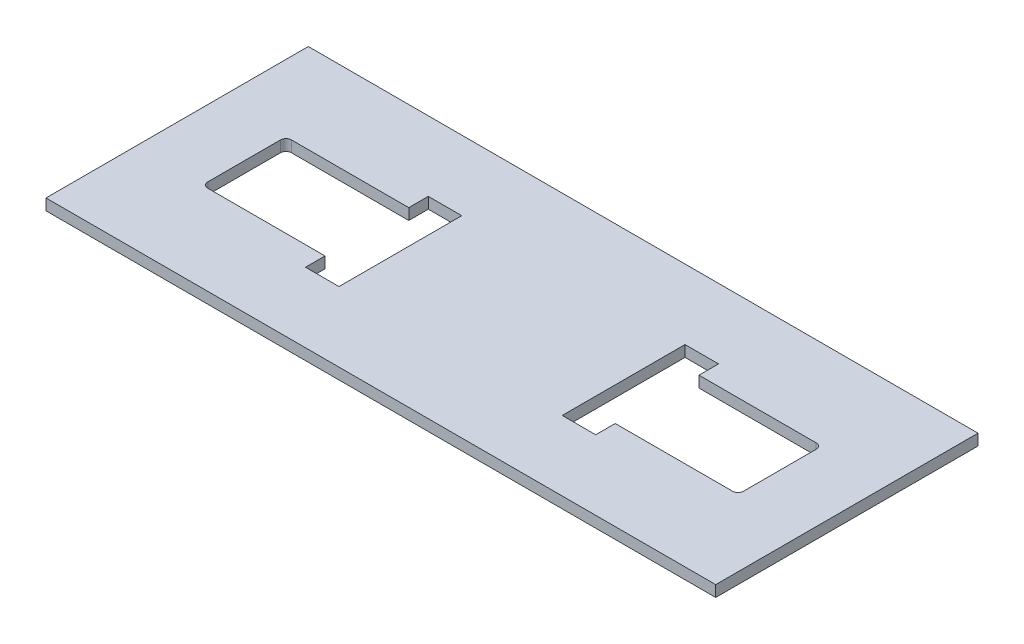
from build123d import *

# Parameters (mm, degrees)
SKETCH1_W           = 381
SKETCH1_H           = 149.225
BOSS_EXTRUDE1_DEPTH = 6.35
SKETCH9_W           = 19.05
SKETCH9_H           = 14.2875
CUT_EXTRUDE1_DEPTH  = 7.62


with BuildPart() as part:
    # Sketch1 → Boss-Extrude1 (new body)
    with BuildSketch(Plane(origin=(0, 0, 0), x_dir=(1, 0, 0), z_dir=(0, 1, 0))):
        with Locations((190.5, 74.6125)):
            Rectangle(SKETCH1_W, SKETCH1_H)
        with BuildLine():
            Line((342.9, 95.25), (342.9, 53.975))
            ThreePointArc((342.9, 53.975), (341.97006403, 51.72993597), (339.725, 50.8))
            Line((339.725, 50.8), (257.175, 50.8))
            ThreePointArc((257.175, 50.8), (254.92993597, 51.72993597), (254, 53.975))
            Line((254, 53.975), (254, 95.25))
            ThreePointArc((254, 95.25), (254.92993597, 97.49506403), (257.175, 98.425))
            Line((257.175, 98.425), (339.725, 98.425))
            ThreePointArc((339.725, 98.425), (341.97006403, 97.49506403), (342.9, 95.25))
        make_face(mode=Mode.SUBTRACT)
        with BuildLine():
            Line((41.275, 98.425), (123.825, 98.425))
            ThreePointArc((123.825, 98.425), (126.07006403, 97.49506403), (127, 95.25))
            Line((127, 95.25), (127, 53.975))
            ThreePointArc((127, 53.975), (126.07006403, 51.72993597), (123.825, 50.8))
            Line((123.825, 50.8), (41.275, 50.8))
            ThreePointArc((41.275, 50.8), (39.02993597, 51.72993597), (38.1, 53.975))
            Line((38.1, 53.975), (38.1, 95.25))
            ThreePointArc((38.1, 95.25), (39.02993597, 97.49506403), (41.275, 98.425))
        make_face(mode=Mode.SUBTRACT)
    extrude(amount=BOSS_EXTRUDE1_DEPTH)

    # Sketch9 → Cut-Extrude1 (cut)
    with BuildSketch(Plane(origin=(0, 6.35, 0), x_dir=(1, 0, 0), z_dir=(0, 1, 0))):
        with Locations((117.475, 102.39375)):
            Rectangle(SKETCH9_W, SKETCH9_H)
        with Locations((117.475, 46.83125)):
            Rectangle(SKETCH9_W, SKETCH9_H)
        with Locations((263.525, 46.83125)):
            Rectangle(SKETCH9_W, SKETCH9_H)
        with Locations((263.525, 102.39375)):
            Rectangle(SKETCH9_W, SKETCH9_H)
    extrude(amount=-CUT_EXTRUDE1_DEPTH, mode=Mode.SUBTRACT)


solid = part.part
